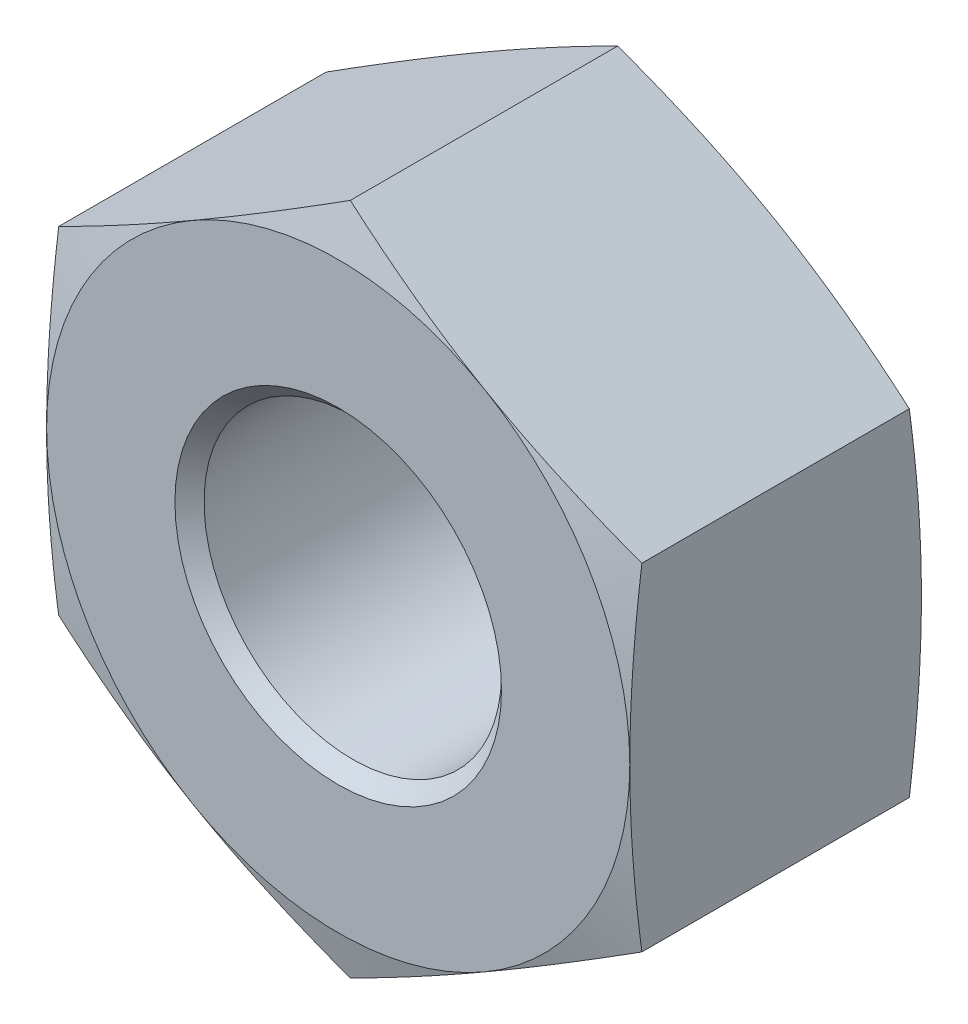
from build123d import *

# Parameters (mm, degrees)
RESSALTO_EXTRUS_O1_DEPTH = 10
ESBO_O2_OUTSIDE_W        = 140.39
ESBO_O2_OUTSIDE_H        = 143.484
ESBO_O2_OUTSIDE_R        = 10
CORTE_EXTRUS_O1_DEPTH    = 15
CORTE_EXTRUS_O1_DRAFT    = -75
ESBO_O3_OUTSIDE_W        = 140.39
ESBO_O3_OUTSIDE_H        = 143.484
ESBO_O3_OUTSIDE_R        = 10
CORTE_EXTRUS_O2_DEPTH    = 15
CORTE_EXTRUS_O2_DRAFT    = -75
FURO_ROSCADO_DE_M121_D   = 10.2
CHANFRO3_SIZE            = 0.5
CHANFRO4_SIZE            = 0.5


with BuildPart() as part:
    # Esboço1 → Ressalto-extrusão1 (new body)
    with BuildSketch(Plane.XY):
        Polygon((0, 11.547005384), (-10, 5.773502692), (-10, -5.773502692), (0, -11.547005384), (10, -5.773502692), (10, 5.773502692), align=None)
    extrude(amount=RESSALTO_EXTRUS_O1_DEPTH)


with BuildPart() as corte_extrus_o1_tool:
    # Esboço2 outside → Corte-extrusão1 (with draft: the straight prism first)
    with BuildSketch(Plane.XY.offset(10)):
        Rectangle(ESBO_O2_OUTSIDE_W, ESBO_O2_OUTSIDE_H)
        Circle(ESBO_O2_OUTSIDE_R, mode=Mode.SUBTRACT)
    extrude(amount=-CORTE_EXTRUS_O1_DEPTH)
    # Corte-extrusão1: the draft: its side faces are tilted about the plane it starts from
    corte_extrus_o1_sides = [corte_extrus_o1_tool.faces().sort_by_distance(p)[0] for p in [
        (0, -71.742, 2.5),
        (70.195, 0, 2.5),
        (0, 71.742, 2.5),
        (-70.195, 0, 2.5),
        (-10, 0, 2.5),
    ]]
    draft(corte_extrus_o1_sides, Plane.XY.offset(10), CORTE_EXTRUS_O1_DRAFT)


with BuildPart() as part_1:
    add(part.part)

    # Corte-extrusão1: cut by corte_extrus_o1_tool
    add(corte_extrus_o1_tool.part, mode=Mode.SUBTRACT)


with BuildPart() as corte_extrus_o2_tool:
    # Esboço3 outside → Corte-extrusão2 (with draft: the straight prism first)
    with BuildSketch(Plane(origin=(0, 0, 0), x_dir=(-1, 0, 0), z_dir=(0, 0, -1))):
        Rectangle(ESBO_O3_OUTSIDE_W, ESBO_O3_OUTSIDE_H)
        Circle(ESBO_O3_OUTSIDE_R, mode=Mode.SUBTRACT)
    extrude(amount=-CORTE_EXTRUS_O2_DEPTH)
    # Corte-extrusão2: the draft: its side faces are tilted about the plane it starts from
    corte_extrus_o2_sides = [corte_extrus_o2_tool.faces().sort_by_distance(p)[0] for p in [
        (0, -71.742, 7.5),
        (-70.195, 0, 7.5),
        (0, 71.742, 7.5),
        (70.195, 0, 7.5),
        (10, 0, 7.5),
    ]]
    draft(corte_extrus_o2_sides, Plane(origin=(0, 0, 0), x_dir=(-1, 0, 0), z_dir=(0, 0, -1)), CORTE_EXTRUS_O2_DRAFT)


with BuildPart() as part_2:
    add(part_1.part)

    # Corte-extrusão2: cut by corte_extrus_o2_tool
    add(corte_extrus_o2_tool.part, mode=Mode.SUBTRACT)

    # Furo roscado de M121 (through all)
    with Locations(Plane(origin=(0, 0, 0), x_dir=(-1, 0, 0), z_dir=(0, 0, -1))):
        with Locations((0, 0)):
            Hole(FURO_ROSCADO_DE_M121_D / 2)

    # Chanfro3
    chanfro3_edges = [part_2.edges().sort_by_distance(p)[0] for p in [
        (-5.1, 0, 10),
    ]]
    chamfer(chanfro3_edges, length=CHANFRO3_SIZE)

    # Chanfro4
    chanfro4_edges = [part_2.edges().sort_by_distance(p)[0] for p in [
        (-5.1, 0, 0),
    ]]
    chamfer(chanfro4_edges, length=CHANFRO4_SIZE)


solid = part_2.part
